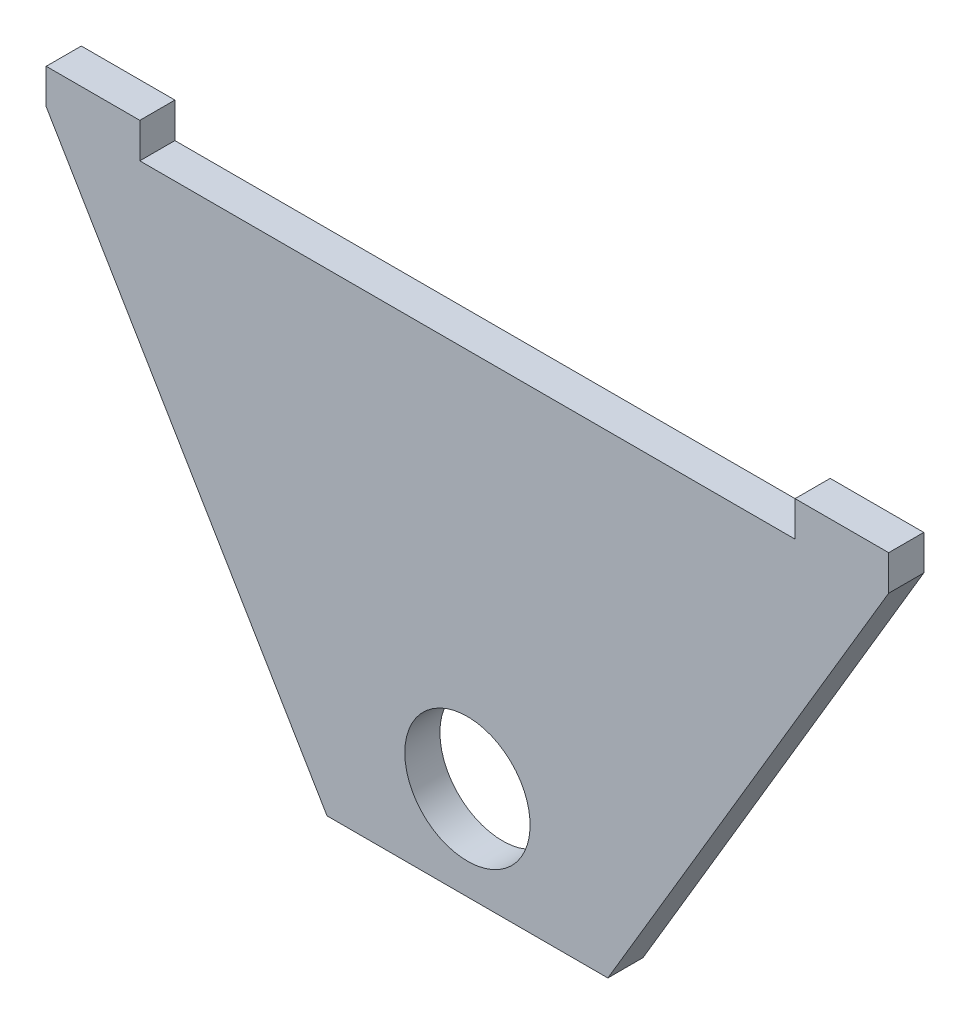
from build123d import *

# Parameters (mm, degrees)
SKETCH1_R           = 8.5
BOSS_EXTRUDE1_DEPTH = 4.7625


with BuildPart() as part:
    # Sketch1 → Boss-Extrude1 (new body)
    with BuildSketch(Plane.XY):
        Polygon((-38.1, 69.0245), (-25.4, 69.0245), (-25.4, 64.262), (63.5, 64.262), (63.5, 69.0245), (76.2, 69.0245), (76.2, 64.262), (38.1, 0), (0, 0), (-38.1, 64.262), align=None)
        with Locations(Location((19.05, 12.7, 0), (0, 0, 180))):
            Circle(SKETCH1_R, mode=Mode.SUBTRACT)
    extrude(amount=BOSS_EXTRUDE1_DEPTH)


solid = part.part
